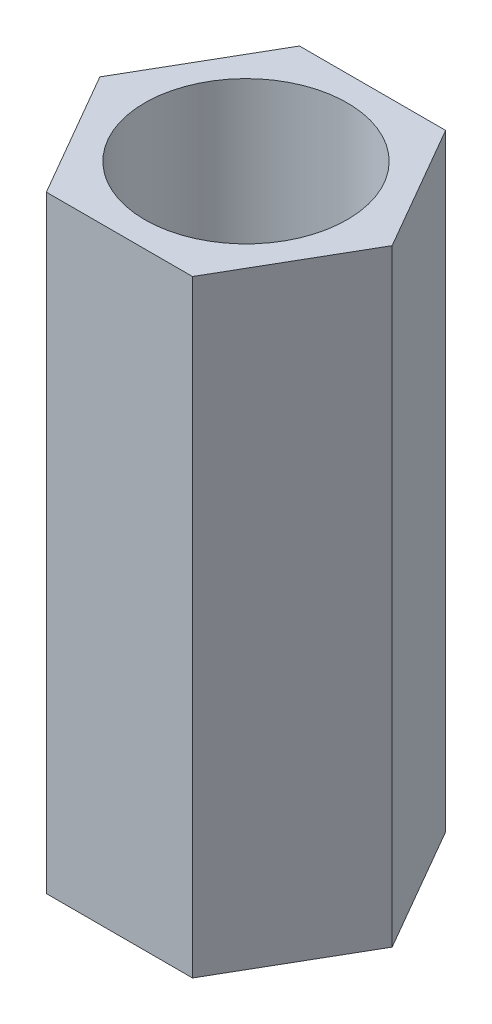
from build123d import *

# Parameters (mm, degrees)
SKETCH_1_R      = 2
EXTRUDE_1_DEPTH = 12


with BuildPart() as part:
    # 草图1 → 凸台-拉伸1 (new body)
    with BuildSketch(Plane(origin=(0, 0, 0), x_dir=(1, 0, 0), z_dir=(0, 1, 0))):
        Polygon((1.443375673, 2.5), (-1.443375673, 2.5), (-2.886751346, 0), (-1.443375673, -2.5), (1.443375673, -2.5), (2.886751346, 0), align=None)
        with Locations(Location((0, 0, 0), (0, 0, 270))):
            Circle(SKETCH_1_R, mode=Mode.SUBTRACT)
    extrude(amount=EXTRUDE_1_DEPTH)


solid = part.part
